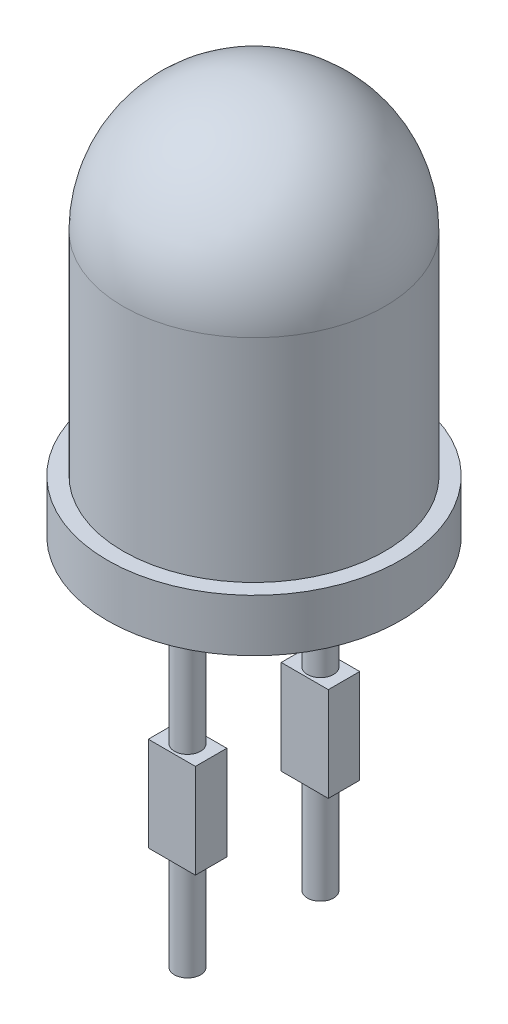
from build123d import *

# Parameters (mm, degrees)
SKETCH2_R               = 0.25
BOSS_EXTRUDE1_DEPTH     = 11
BOSS_EXTRUDE1_2_DEPTH   = 11
SKETCH3_W               = 0.6
SKETCH3_H               = 1.8
BOSS_EXTRUDE2_DEPTH     = 0.45
CUT_EXTRUDE1_DEPTH      = 15.573284633
CUT_EXTRUDE1_DEPTH_BACK = 15.573284633
SKETCH4_W               = 5.043889868
SKETCH4_H               = 6.467062113


with BuildPart() as part:
    # Sketch1 → Revolve1 (revolve)
    with BuildSketch(Plane(origin=(0, 0, 0), x_dir=(0, 0, -1), z_dir=(1, 0, 0))):
        with BuildLine():
            Line((-2.5, 2.025), (-2.5, -2.025))
            Line((-2.5, -2.025), (-2.8, -2.025))
            Line((-2.8, -2.025), (-2.8, -3.025))
            Line((-2.8, -3.025), (0, -3.025))
            Line((0, -3.025), (0, 4.525))
            ThreePointArc((0, 4.525), (-1.767766953, 3.792766953), (-2.5, 2.025))
        make_face()
    revolve(axis=Axis((0, 4.525, 0), (0, -1, 0)))


with BuildPart() as body_2:
    # Sketch2 → Boss-Extrude1 (new body)
    with BuildSketch(Plane.XZ.offset(3.025)):
        with Locations(Location((0, 1.27, 0), (0, 0, 270))):
            Circle(SKETCH2_R)
    extrude(amount=BOSS_EXTRUDE1_DEPTH)



with BuildPart() as body_3:
    # Sketch2 → Boss-Extrude1 2 (new body)
    with BuildSketch(Plane.XZ.offset(3.025)):
        with Locations(Location((0, -1.27, 0), (0, 0, 90))):
            Circle(SKETCH2_R)
    extrude(amount=BOSS_EXTRUDE1_2_DEPTH)


with BuildPart() as body_2_1:
    add(body_2.part)

    add(body_3.part)  # Boss-Extrude2 merges body 3
    # Sketch3 → Boss-Extrude2 (add, symmetric)
    with BuildSketch(Plane(origin=(0, 0, 0), x_dir=(0, 0, -1), z_dir=(1, 0, 0))):
        with Locations((1.27, -6.725)):
            Rectangle(SKETCH3_W, SKETCH3_H)
        with Locations((-1.27, -6.725)):
            Rectangle(SKETCH3_W, SKETCH3_H)
    extrude(amount=BOSS_EXTRUDE2_DEPTH, both=True)

    # Sketch4 → Cut-Extrude1 (cut, two sides: drawn at the far end of the back side and taken through both)
    with BuildSketch(Plane(origin=(0, 0, 0), x_dir=(0, 0, -1), z_dir=(1, 0, 0)).offset(-CUT_EXTRUDE1_DEPTH_BACK)):
        with Locations((0.376722065, -12.758531057)):
            Rectangle(SKETCH4_W, SKETCH4_H)
    extrude(amount=CUT_EXTRUDE1_DEPTH + CUT_EXTRUDE1_DEPTH_BACK, mode=Mode.SUBTRACT)


solid = Compound([part.part, body_2_1.part])
